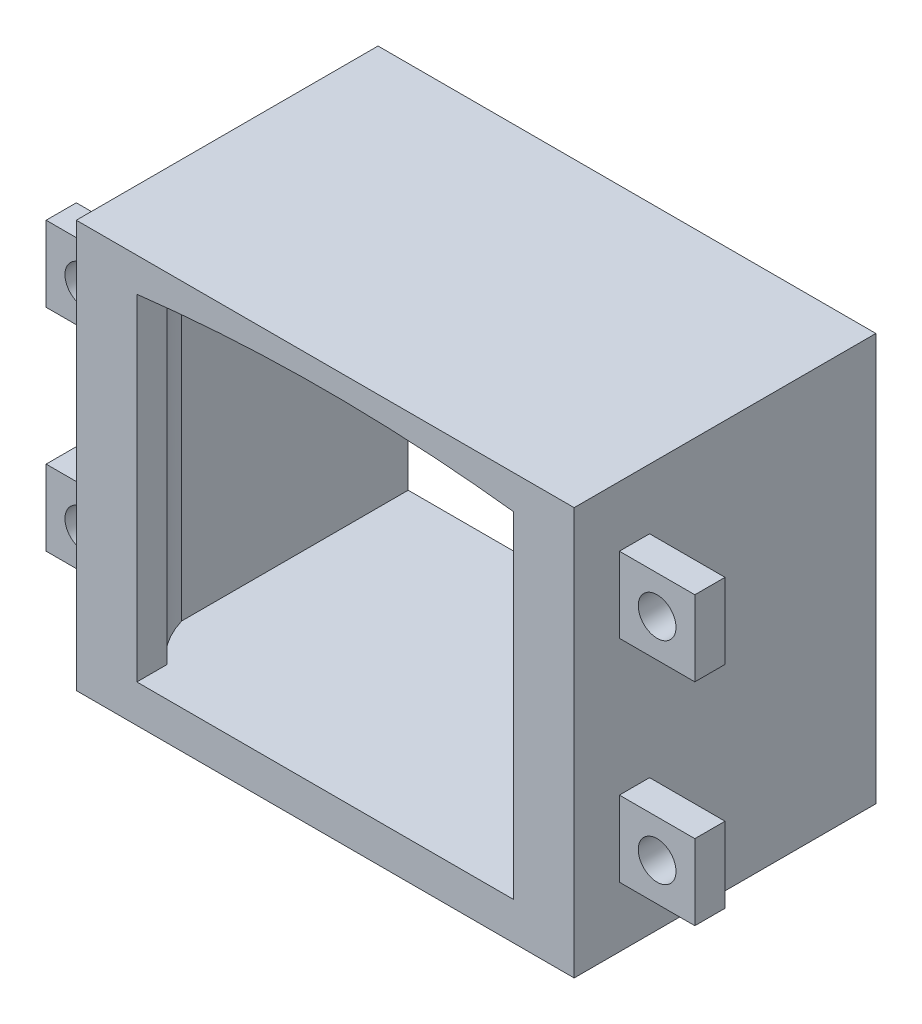
from build123d import *

# Parameters (mm, degrees)
SKETCH2_W           = 33
SKETCH2_H           = 27
BOSS_EXTRUDE1_DEPTH = 20
CUT_EXTRUDE1_DEPTH  = 18
BOSS_EXTRUDE3_DEPTH = 25
CUT_EXTRUDE4_DEPTH  = 2
SKETCH10_W          = 2
SKETCH10_H          = 5
BOSS_EXTRUDE4_DEPTH = 5
SKETCH11_W          = 2
SKETCH11_H          = 5
BOSS_EXTRUDE5_DEPTH = 5
SKETCH12_R          = 1.25
CUT_EXTRUDE5_DEPTH  = 2


with BuildPart() as part:
    # Sketch2 → Boss-Extrude1 (new body)
    with BuildSketch(Plane.XY):
        Rectangle(SKETCH2_W, SKETCH2_H)
    extrude(amount=-BOSS_EXTRUDE1_DEPTH)

    # Sketch3 → Cut-Extrude1 (cut)
    with BuildSketch(Plane(origin=(0, 0, -20), x_dir=(-1, 0, 0), z_dir=(0, 0, -1))):
        with BuildLine():
            Line((-14.5, 11), (-14.5, -11))
            Line((-14.5, -11), (14.5, -11))
            Line((14.5, -11), (14.5, 11))
            add(Edge.make_bspline(
                [(-14.5, 11), (0, 13), (14.5, 11)],
                knots=[0, 0, 0, 1, 1, 1], degree=2))
        make_face()
    extrude(amount=-CUT_EXTRUDE1_DEPTH, mode=Mode.SUBTRACT)

    # Sketch4 → Boss-Extrude3 (add)
    with BuildSketch(Plane(origin=(0, 13.5, 0), x_dir=(1, 0, 0), z_dir=(0, 1, 0))):
        with BuildLine():
            Line((14.504051414, 5), (14.504051414, 2))
            Line((14.504051414, 2), (14.504051414, 1))
            Line((14.504051414, 1), (10.553086369, 1))
            add(Edge.make_bspline(
                [(14.504051414, 5), (13.626897644, 2.036892848), (10.553086369, 1)],
                knots=[0, 0, 0, 1, 1, 1], degree=2))
        make_face()
        with BuildLine():
            add(Edge.make_bspline(
                [(-14.504051414, 5), (-13.626897644, 2.036892848), (-10.553086369, 1)],
                knots=[0, 0, 0, 1, 1, 1], degree=2))
            Line((-10.553086369, 1), (-14.504051414, 1))
            Line((-14.504051414, 1), (-14.504051414, 2))
            Line((-14.504051414, 2), (-14.504051414, 5))
        make_face()
    extrude(amount=-BOSS_EXTRUDE3_DEPTH)

    # Sketch9 → Cut-Extrude4 (cut)
    with BuildSketch(Plane(origin=(0, 0, -2), x_dir=(-1, 0, 0), z_dir=(0, 0, -1))):
        with BuildLine():
            Line((-12.486551431, 11.258435355), (-12.486551431, -11))
            Line((-12.486551431, -11), (12.486551431, -11))
            Line((12.486551431, -11), (12.486551431, 11.258435355))
            add(Edge.make_bspline(
                [(-12.486551431, 11.258435355), (0, 12.741564645), (12.486551431, 11.258435355)],
                knots=[0, 0, 0, 1, 1, 1], degree=2))
        make_face()
    extrude(amount=-CUT_EXTRUDE4_DEPTH, mode=Mode.SUBTRACT)

    # Sketch10 → Boss-Extrude4 (add)
    with BuildSketch(Plane.ZY.offset(16.5)):
        with Locations((-4, 7)):
            Rectangle(SKETCH10_W, SKETCH10_H)
        with Locations((-4, -7)):
            Rectangle(SKETCH10_W, SKETCH10_H)
    extrude(amount=BOSS_EXTRUDE4_DEPTH)

    # Sketch11 → Boss-Extrude5 (add)
    with BuildSketch(Plane(origin=(16.5, 0, 0), x_dir=(0, 0, -1), z_dir=(1, 0, 0))):
        with Locations((4, 7)):
            Rectangle(SKETCH11_W, SKETCH11_H)
        with Locations((4, -7)):
            Rectangle(SKETCH11_W, SKETCH11_H)
    extrude(amount=BOSS_EXTRUDE5_DEPTH)

    # Sketch12 → Cut-Extrude5 (cut)
    with BuildSketch(Plane.XY.offset(-3)):
        with Locations((19, -7)):
            Circle(SKETCH12_R)
        with Locations((19, 7)):
            Circle(SKETCH12_R)
        with Locations((-19, 7)):
            Circle(SKETCH12_R)
        with Locations((-19, -7)):
            Circle(SKETCH12_R)
    extrude(amount=-CUT_EXTRUDE5_DEPTH, mode=Mode.SUBTRACT)


solid = part.part
